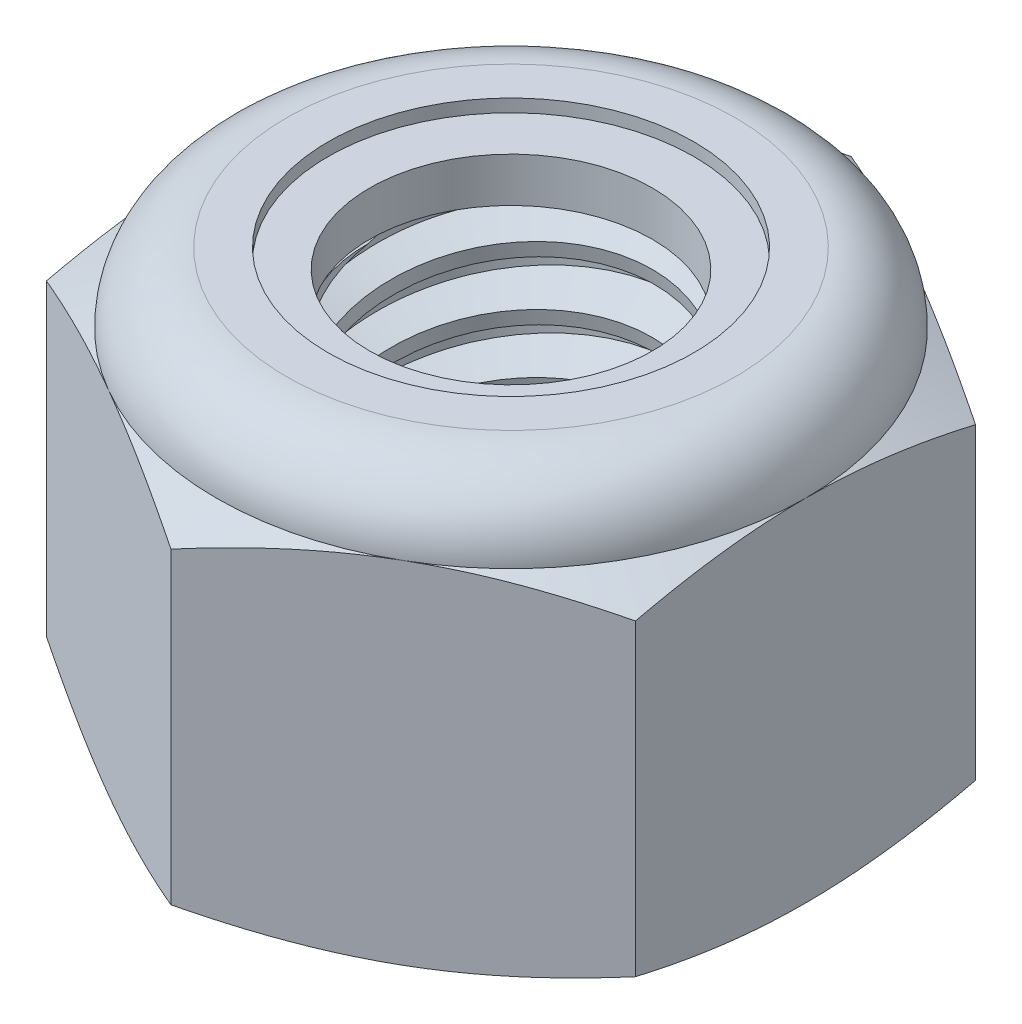
from build123d import *

# Parameters (mm, degrees)
EXTRUDE1_DEPTH      = 5
SKETCH2_W           = 2
SKETCH2_H           = 5
LPATTERN1_COUNT     = 7
LPATTERN1_PITCH     = 0.7
LPATTERN1_COL_COUNT = 2
LPATTERN1_COL_PITCH = 0.7


with BuildPart() as part:
    # Sketch1 → Extrude1 (new body)
    with BuildSketch(Plane(origin=(0, 0, 0), x_dir=(1, 0, 0), z_dir=(0, 1, 0))):
        Polygon((0, 4.041451884), (-3.5, 2.020725942), (-3.5, -2.020725942), (0, -4.041451884), (3.5, -2.020725942), (3.5, 2.020725942), align=None)
    extrude(amount=EXTRUDE1_DEPTH)

    # Sketch4 → Cut-Revolve2 (revolve, cut)
    with BuildSketch(Plane(origin=(0, 0, 0), x_dir=(0, 0, -1), z_dir=(1, 0, 0)), mode=Mode.PRIVATE) as cut_revolve2_sk:
        Polygon((0, 5), (2, 5), (1.679577111, 4.850584353), (1.679577111, 0.149415647), (2, 0), (0, 0), align=None)
    revolve(cut_revolve2_sk.sketch.rotate(Axis((0, 5, 0), (0, 1, 0)), 54.612382926), axis=Axis((0, 5, 0), (0, 1, 0)), mode=Mode.SUBTRACT)


with BuildPart() as body_2:
    # Sketch2 → Revolve1 (revolve)
    with BuildSketch(Plane(origin=(0, 0, 0), x_dir=(0, 0, -1), z_dir=(1, 0, 0))):
        with Locations((1, 2.5)):
            Rectangle(SKETCH2_W, SKETCH2_H)
    revolve(axis=Axis((0, -2, 0), (0, 1, 0)))

    # Sketch3 → Cut-Revolve1 (revolve, cut)
    with BuildSketch(Plane(origin=(0, 0, 0), x_dir=(0, 0, -1), z_dir=(1, 0, 0)), mode=Mode.PRIVATE) as cut_revolve1_sk:
        Polygon((2.015083279, 4.913809834), (2.120666232, 4.310478673), (1.709743669, 4.460641574), (1.679577111, 4.633021905), align=None)
    cut_revolve1 = revolve(cut_revolve1_sk.sketch.rotate(Axis((0, 5, 0.13120342), (0, -0.9850304671557042, -0.17238033175224862)), 180), axis=Axis((0, 5, 0.13120342), (0, -0.9850304671557042, -0.17238033175224862)), mode=Mode.SUBTRACT)

    # LPattern1: Cut-Revolve1 ×7
    with Locations(*[(0, -i * LPATTERN1_PITCH, 0) for i in range(1, LPATTERN1_COUNT)]):
        add(cut_revolve1, mode=Mode.SUBTRACT)

    # LPattern1 col: Cut-Revolve1 ×2
    with Locations(*[(0, i * LPATTERN1_COL_PITCH, 0) for i in range(1, LPATTERN1_COL_COUNT)]):
        add(cut_revolve1, mode=Mode.SUBTRACT)


with BuildPart() as part_1:
    add(part.part)

    # Combine1: cut body 2
    add(body_2.part, mode=Mode.SUBTRACT)

    # Sketch5 → Cut-Revolve3 (revolve, cut)
    with BuildSketch(Plane(origin=(0, 0, 0), x_dir=(0, 0, -1), z_dir=(1, 0, 0)), mode=Mode.PRIVATE) as cut_revolve3_sk:
        with BuildLine():
            Line((0, 0), (3.5, 0))
            Line((3.5, 0), (4.041451884, 0.25248316))
            Line((4.041451884, 0.25248316), (4.041451884, 3.914183506))
            Line((4.041451884, 3.914183506), (3.5, 4.166666667))
            ThreePointArc((3.5, 4.166666667), (3.255922318, 4.755922318), (2.666666667, 5))
            Line((2.666666667, 5), (2.666666667, 6.27))
            Line((2.666666667, 6.27), (5.311451884, 6.27))
            Line((5.311451884, 6.27), (5.311451884, -1.27))
            Line((5.311451884, -1.27), (0, -1.27))
            Line((0, -1.27), (0, 0))
        make_face()
    revolve(cut_revolve3_sk.sketch.rotate(Axis((0, 0, 0), (0, 1, 0)), 54.612382926), axis=Axis((0, 0, 0), (0, 1, 0)), mode=Mode.SUBTRACT)

    # Sketch6 → Cut-Revolve4 (revolve, cut)
    with BuildSketch(Plane(origin=(0, 0, 0), x_dir=(0, 0, -1), z_dir=(1, 0, 0)), mode=Mode.PRIVATE) as cut_revolve4_sk:
        with BuildLine():
            Line((0, 4.166666667), (3.3476, 4.166666667))
            ThreePointArc((3.3476, 4.166666667), (3.148159244, 4.648159244), (2.666666667, 4.8476))
            Line((2.666666667, 4.8476), (2.173121889, 4.8476))
            Line((2.173121889, 4.8476), (2.173121889, 6.27))
            Line((2.173121889, 6.27), (0, 6.27))
            Line((0, 6.27), (0, 4.166666667))
        make_face()
    revolve(cut_revolve4_sk.sketch.rotate(Axis((0, 6.27, 0), (0, 1, 0)), 54.612382926), axis=Axis((0, 6.27, 0), (0, 1, 0)), mode=Mode.SUBTRACT)


with BuildPart() as body_2_2:
    # Sketch7 → Revolve2 (revolve)
    with BuildSketch(Plane(origin=(0, 0, 0), x_dir=(0, 0, -1), z_dir=(1, 0, 0))):
        with BuildLine():
            Line((1.679577111, 4.242866667), (3.266579964, 4.242866667))
            ThreePointArc((3.266579964, 4.242866667), (3.066430175, 4.620419399), (2.666666667, 4.7714))
            Line((2.666666667, 4.7714), (1.679577111, 4.7714))
            Line((1.679577111, 4.7714), (1.679577111, 4.242866667))
        make_face()
    revolve(axis=Axis((0, 4.242866667, 0), (0, 1, 0)))


solid = Compound([part_1.part, body_2_2.part])
